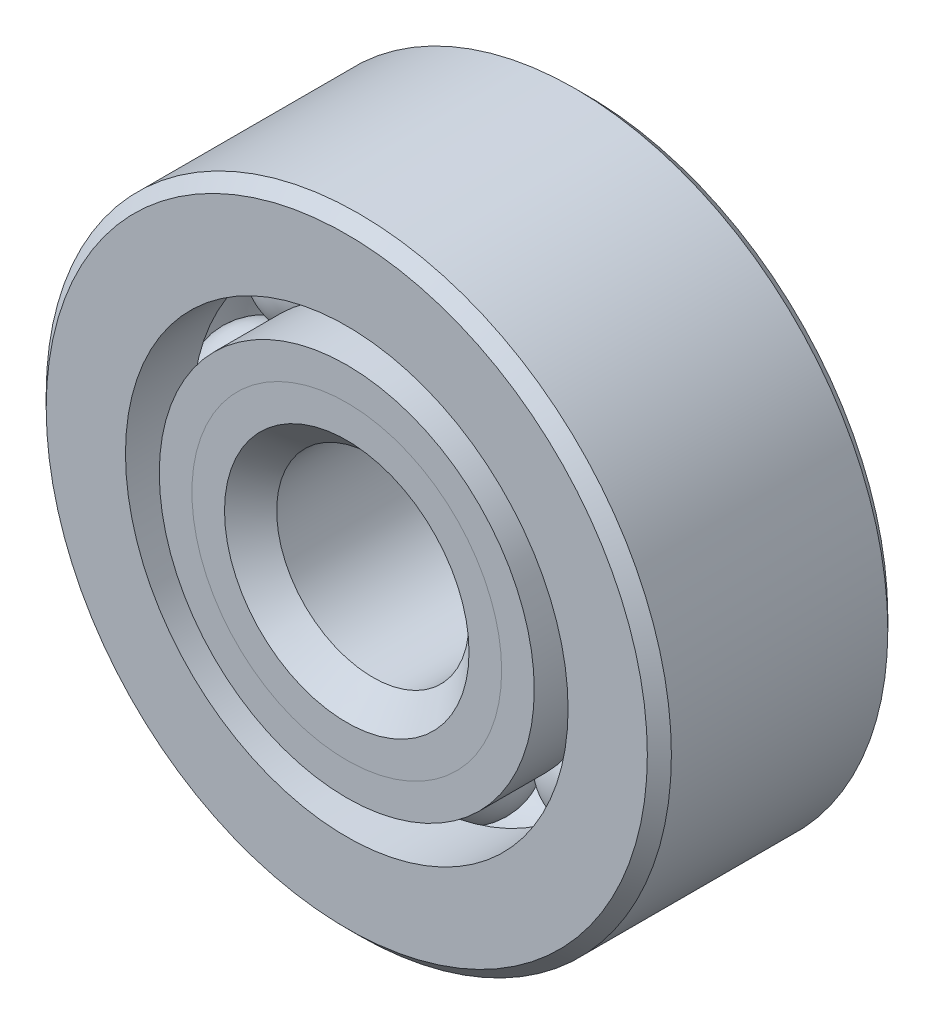
from build123d import *

# Parameters (mm, degrees)
CIRPATTERN1_COUNT = 8


with BuildPart() as part:
    # Sketch1 → Revolve1 (revolve)
    with BuildSketch(Plane(origin=(0, 0, 0), x_dir=(0, 0, -1), z_dir=(1, 0, 0)), mode=Mode.PRIVATE) as revolve1_sk:
        with BuildLine():
            Line((2.25, 6.5), (-2.25, 6.5))
            Line((-2.25, 6.5), (-2.5, 6.25))
            Line((-2.5, 6.25), (-2.5, 4.601648352))
            Line((-2.5, 4.601648352), (-1.111111111, 4.601648352))
            ThreePointArc((-1.111111111, 4.601648352), (0, 5.415428876), (1.111111111, 4.601648352))
            Line((1.111111111, 4.601648352), (2.5, 4.601648352))
            Line((2.5, 4.601648352), (2.5, 6.25))
            Line((2.5, 6.25), (2.25, 6.5))
        make_face()
    revolve(revolve1_sk.sketch.rotate(Axis((0, 0, 2.5), (0, 0, -1)), 90), axis=Axis((0, 0, 2.5), (0, 0, -1)))


with BuildPart() as body_2:
    # Sketch2 → Revolve2 (revolve)
    with BuildSketch(Plane(origin=(0, 0, 0), x_dir=(0, 0, -1), z_dir=(1, 0, 0)), mode=Mode.PRIVATE) as revolve2_sk:
        with BuildLine():
            Line((-2.5, 3.898351648), (-1.111111111, 3.898351648))
            ThreePointArc((-1.111111111, 3.898351648), (-0.688623018, 3.309775131), (0, 3.084571124))
            Line((0, 3.084571124), (0, 2.542285562))
            Line((0, 2.542285562), (-1.821966957, 2.542285562))
            Line((-1.821966957, 2.542285562), (-2.5, 3.220318605))
            Line((-2.5, 3.220318605), (-2.5, 3.898351648))
        make_face()
    revolve(revolve2_sk.sketch.rotate(Axis((0, 0, 2.5), (0, 0, -1)), 90), axis=Axis((0, 0, 2.5), (0, 0, -1)))


with BuildPart() as body_3:
    # Sketch3 → Revolve3 (revolve)
    with BuildSketch(Plane(origin=(0, 0, 0), x_dir=(0, 0, -1), z_dir=(1, 0, 0)), mode=Mode.PRIVATE) as revolve3_sk:
        with BuildLine():
            Line((-2.5, 3.220318605), (-1.821966957, 2.542285562))
            Line((-1.821966957, 2.542285562), (0, 2.542285562))
            Line((0, 2.542285562), (0, 3.084571124))
            ThreePointArc((0, 3.084571124), (0.688623018, 3.309775131), (1.111111111, 3.898351648))
            Line((1.111111111, 3.898351648), (2.5, 3.898351648))
            Line((2.5, 3.898351648), (2.5, 2.25))
            Line((2.5, 2.25), (2.25, 2))
            Line((2.25, 2), (-1.957714438, 2))
            Line((-1.957714438, 2), (-2.5, 2.542285562))
            Line((-2.5, 2.542285562), (-2.5, 3.220318605))
        make_face()
    revolve(revolve3_sk.sketch.rotate(Axis((0, 0, 2.5), (0, 0, -1)), 90), axis=Axis((0, 0, 2.5), (0, 0, -1)))


with BuildPart() as body_4:
    # Sketch4 → Revolve4 (revolve)
    with BuildSketch(Plane(origin=(0, 0, 0), x_dir=(0, 0, -1), z_dir=(1, 0, 0))):
        with BuildLine():
            Line((-1.165428876, 4.25), (1.165428876, 4.25))
            ThreePointArc((1.165428876, 4.25), (0, 5.415428876), (-1.165428876, 4.25))
        make_face()
    revolve(axis=Axis((0, 4.25, 1.165428876), (0, 0, -1)))


with BuildPart() as cirpattern1_1:
    # CirPattern1: pattern copy
    add(body_4.part.rotate(Axis((0, 0, 0), (0, 0, 1)), 1 * 360 / CIRPATTERN1_COUNT))


with BuildPart() as cirpattern1_2:
    # CirPattern1: pattern copy
    add(body_4.part.rotate(Axis((0, 0, 0), (0, 0, 1)), 2 * 360 / CIRPATTERN1_COUNT))


with BuildPart() as cirpattern1_3:
    # CirPattern1: pattern copy
    add(body_4.part.rotate(Axis((0, 0, 0), (0, 0, 1)), 3 * 360 / CIRPATTERN1_COUNT))


with BuildPart() as cirpattern1_4:
    # CirPattern1: pattern copy
    add(body_4.part.rotate(Axis((0, 0, 0), (0, 0, 1)), 4 * 360 / CIRPATTERN1_COUNT))


with BuildPart() as cirpattern1_5:
    # CirPattern1: pattern copy
    add(body_4.part.rotate(Axis((0, 0, 0), (0, 0, 1)), 5 * 360 / CIRPATTERN1_COUNT))


with BuildPart() as cirpattern1_6:
    # CirPattern1: pattern copy
    add(body_4.part.rotate(Axis((0, 0, 0), (0, 0, 1)), 6 * 360 / CIRPATTERN1_COUNT))


with BuildPart() as cirpattern1_7:
    # CirPattern1: pattern copy
    add(body_4.part.rotate(Axis((0, 0, 0), (0, 0, 1)), 7 * 360 / CIRPATTERN1_COUNT))


solid = Compound([part.part, body_2.part, body_3.part, body_4.part, cirpattern1_1.part, cirpattern1_2.part, cirpattern1_3.part, cirpattern1_4.part, cirpattern1_5.part, cirpattern1_6.part, cirpattern1_7.part])
